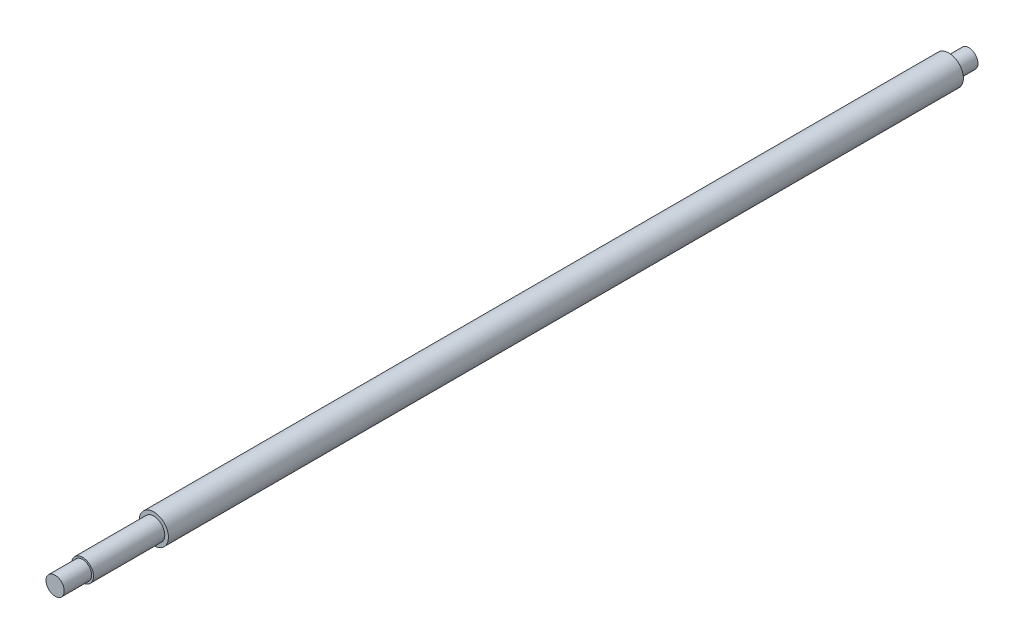
from build123d import *


with BuildPart() as part:
    # Sketch1 → Revolve1 (revolve)
    with BuildSketch(Plane(origin=(0, 0, 0), x_dir=(1, 0, 0), z_dir=(0, 1, 0))):
        Polygon((0, 0), (5, 0), (5, 15), (6, 15), (6, 54), (8, 54), (8, 489), (5, 489), (5, 500), (0, 500), align=None)
    revolve(axis=Axis((0, 0, 0), (0, 0, -1)))


solid = part.part
